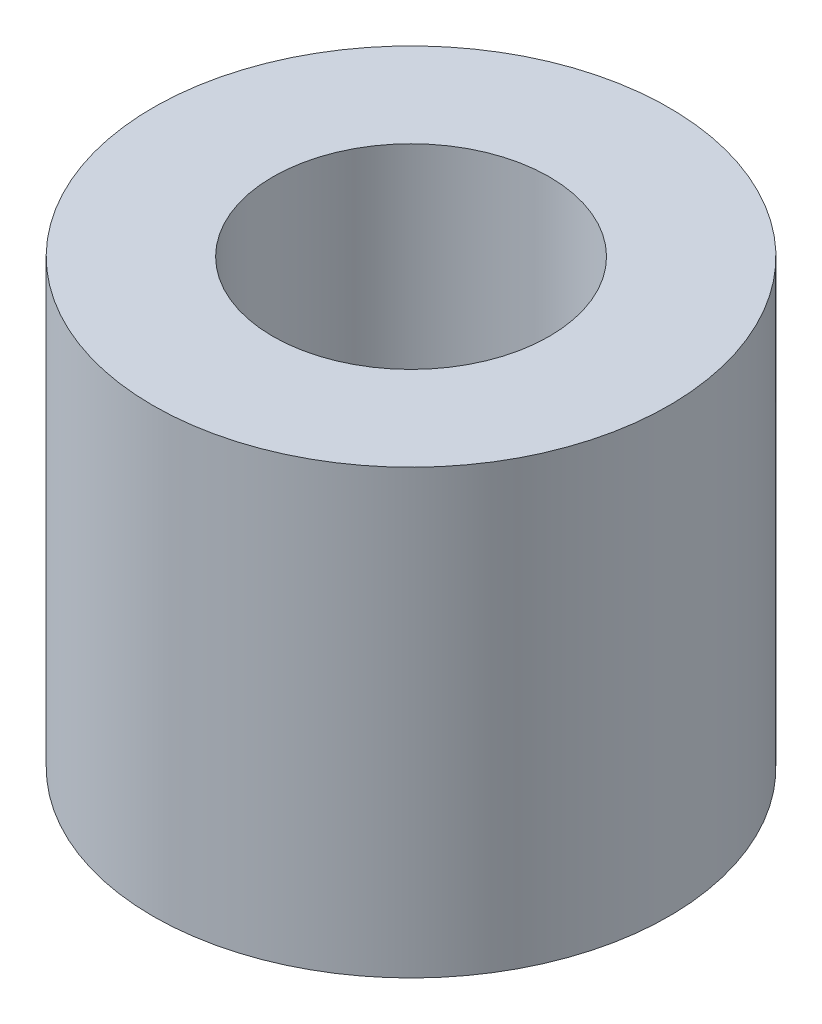
from build123d import *

# Parameters (mm, degrees)
CROQUIS1_R              = 3.5
CROQUIS1_R_2            = 1.875
SALIENTE_EXTRUIR1_DEPTH = 6


with BuildPart() as part:
    # Croquis1 → Saliente-Extruir1 (new body)
    with BuildSketch(Plane(origin=(0, 0, 0), x_dir=(1, 0, 0), z_dir=(0, 1, 0))):
        with Locations(Location((0, 0, 0), (0, 0, 270))):
            Circle(CROQUIS1_R)
        with Locations(Location((0, 0, 0), (0, 0, 270))):
            Circle(CROQUIS1_R_2, mode=Mode.SUBTRACT)
    extrude(amount=SALIENTE_EXTRUIR1_DEPTH)


solid = part.part
